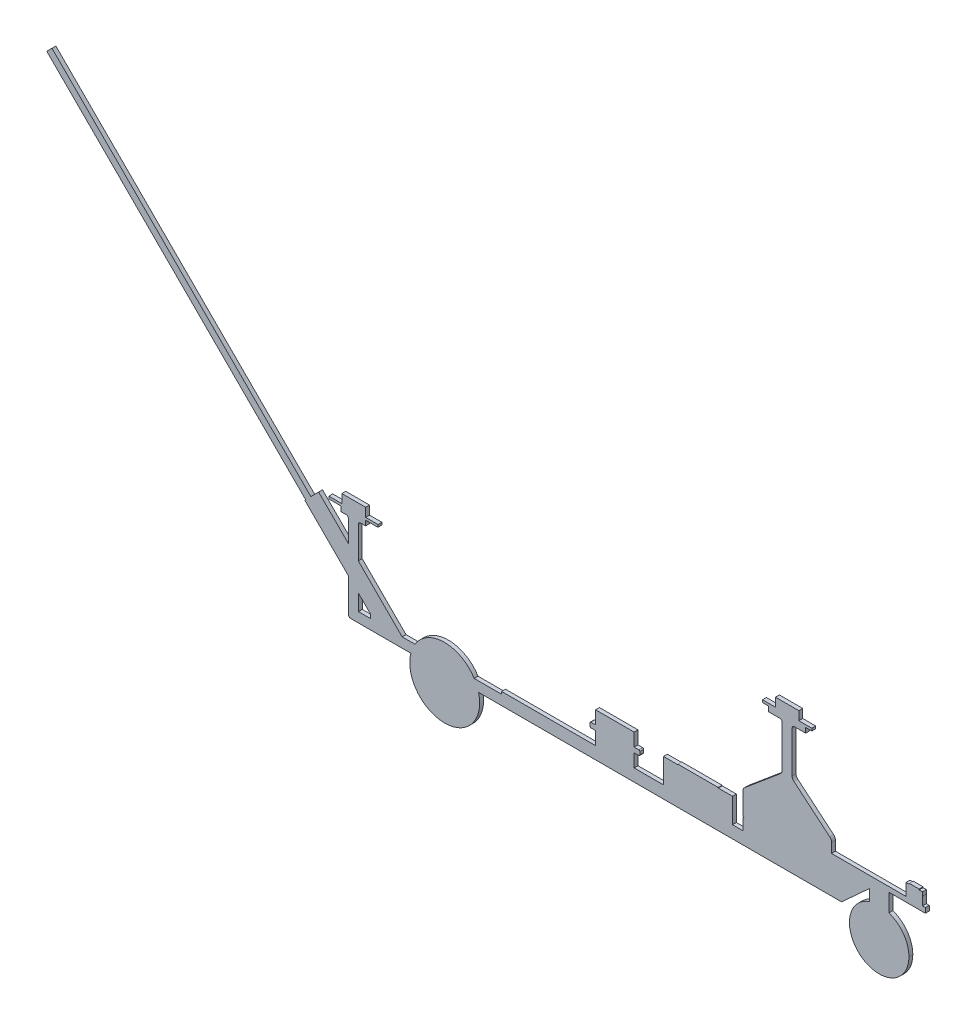
from build123d import *

# Parameters (mm, degrees)
BOSS_EXTRUDE1_DEPTH = 10


with BuildPart() as part:
    # Sketch1 → Boss-Extrude1 (new body)
    with BuildSketch(Plane.XY):
        with BuildLine():
            Line((267.700586575, -317.463793829), (267.700586575, -312.078793829))
            ThreePointArc((267.700586575, -312.078793829), (268.444535351, -310.282742605), (270.240586575, -309.538793829))
            Line((270.240586575, -309.538793829), (270.259460872, -309.538793829))
            Line((270.259460872, -309.538793829), (274.922570072, -309.538793829))
            Line((274.922570072, -309.538793829), (282.23008886, -309.538793829))
            Line((282.23008886, -309.538793829), (282.23008886, -275.862793829))
            Line((282.23008886, -275.862793829), (287.339585458, -275.862793829))
            Line((287.339585458, -275.862793829), (290.091295578, -275.862793829))
            Line((290.091295578, -275.862793829), (379.171025481, -275.862793829))
            Line((379.171025481, -275.862793829), (381.489649894, -275.862793829))
            Line((381.489649894, -275.862793829), (381.489649894, -309.538793829))
            Line((381.489649894, -309.538793829), (385.417639714, -309.538793829))
            Line((385.417639714, -309.538793829), (389.233213281, -309.538793829))
            Line((389.233213281, -309.538793829), (393.479152179, -309.538793829))
            ThreePointArc((393.479152179, -309.538793829), (395.275203403, -310.282742605), (396.019152179, -312.078793829))
            Line((396.019152179, -312.078793829), (396.019152179, -317.463793829))
            Line((396.019152179, -317.463793829), (396.019152179, -319.673793829))
            ThreePointArc((396.019152179, -319.673793829), (395.275203403, -321.469845053), (393.479152179, -322.213793829))
            Line((393.479152179, -322.213793829), (388.951444663, -322.213793829))
            Line((388.951444663, -322.213793829), (385.417639714, -322.213793829))
            Line((385.417639714, -322.213793829), (381.489649894, -322.213793829))
            Line((381.489649894, -322.213793829), (381.489649894, -355.889793829))
            Line((381.489649894, -355.889793829), (457.115985877, -355.889793829))
            Line((457.115985877, -355.889793829), (457.115985877, -349.539793829))
            Line((457.115985877, -349.539793829), (457.115985877, -292.389793829))
            Line((457.115985877, -292.389793829), (476.419985877, -292.389793829))
            Line((476.419985877, -292.389793829), (488.865985877, -292.389793829))
            Line((488.865985877, -292.389793829), (493.945985877, -292.389793829))
            Line((493.945985877, -292.389793829), (493.945985877, -291.119793829))
            Line((493.945985877, -291.119793829), (598.085985877, -291.119793829))
            Line((598.085985877, -291.119793829), (598.085985877, -292.389793829))
            Line((598.085985877, -292.389793829), (603.165985877, -292.389793829))
            Line((603.165985877, -292.389793829), (615.611985877, -292.389793829))
            Line((615.611985877, -292.389793829), (634.915985877, -292.389793829))
            Line((634.915985877, -292.389793829), (634.915985877, -349.539793829))
            Line((634.915985877, -349.539793829), (634.915985877, -355.889793829))
            Line((634.915985877, -355.889793829), (657.031320189, -355.889793829))
            Line((657.031320189, -355.889793829), (658.400586575, -355.889793829))
            Line((658.400586575, -355.889793829), (659.900586575, -355.889793829))
            Line((659.900586575, -355.889793829), (661.400586575, -355.889793829))
            Line((661.400586575, -355.889793829), (661.400586575, -329.339793829))
            ThreePointArc((661.400586575, -329.339793829), (661.418350042, -328.910347072), (661.471519082, -328.483834339))
            ThreePointArc((661.471519082, -328.483834339), (661.472919202, -328.475486411), (661.474332909, -328.467140773))
            ThreePointArc((661.474332909, -328.467140773), (661.513019714, -328.264310942), (661.559728583, -328.063176929))
            ThreePointArc((661.559728583, -328.063176929), (661.568606086, -328.028621698), (661.577720462, -327.994128189))
            ThreePointArc((661.577720462, -327.994128189), (661.627092054, -327.821784525), (661.682375168, -327.651245176))
            ThreePointArc((661.682375168, -327.651245176), (661.698029995, -327.606317848), (661.714095218, -327.561535631))
            ThreePointArc((661.714095218, -327.561535631), (661.773857223, -327.405192123), (661.83861996, -327.250852959))
            ThreePointArc((661.83861996, -327.250852959), (661.862826954, -327.196517417), (661.88765391, -327.142462335))
            ThreePointArc((661.88765391, -327.142462335), (661.955448181, -327.002554153), (662.027394622, -326.86473517))
            ThreePointArc((662.027394622, -326.86473517), (662.061810069, -326.802175293), (662.097081264, -326.740093863))
            ThreePointArc((662.097081264, -326.740093863), (662.17055696, -326.616773886), (662.247408669, -326.495529053))
            ThreePointArc((662.247408669, -326.495529053), (662.29354611, -326.426135915), (662.340789632, -326.357491027))
            ThreePointArc((662.340789632, -326.357491027), (662.417634036, -326.250634064), (662.497158295, -326.145756204))
            ThreePointArc((662.497158295, -326.145756204), (662.556365424, -326.07111286), (662.616930165, -325.997566785))
            ThreePointArc((662.616930165, -325.997566785), (662.694899071, -325.906776916), (662.774936655, -325.817805372))
            ThreePointArc((662.774936655, -325.817805372), (662.848375111, -325.739667563), (662.92340919, -325.663060703))
            ThreePointArc((662.92340919, -325.663060703), (663.000354965, -325.587683442), (663.078845535, -325.513916146))
            ThreePointArc((663.078845535, -325.513916146), (663.167446902, -325.434214232), (663.257851505, -325.356563701))
            ThreePointArc((663.257851505, -325.356563701), (663.33177553, -325.295677813), (663.406808321, -325.236163672))
            ThreePointArc((663.406808321, -325.236163672), (663.51129552, -325.156938252), (663.617747141, -325.080372634))
            ThreePointArc((663.617747141, -325.080372634), (663.686787171, -325.032849084), (663.756584208, -324.986444482))
            ThreePointArc((663.756584208, -324.986444482), (663.877439818, -324.909842166), (664.000357324, -324.836594095))
            ThreePointArc((664.000357324, -324.836594095), (664.062828156, -324.801095535), (664.125783522, -324.766463549))
            ThreePointArc((664.125783522, -324.766463549), (664.263237394, -324.694710535), (664.402769473, -324.627087601))
            ThreePointArc((664.402769473, -324.627087601), (664.457184656, -324.602090988), (664.51188408, -324.577722652))
            ThreePointArc((664.51188408, -324.577722652), (664.665903182, -324.513097218), (664.82191838, -324.453451695))
            ThreePointArc((664.82191838, -324.453451695), (664.867009853, -324.43727287), (664.912248461, -324.421510143))
            ThreePointArc((664.912248461, -324.421510143), (665.082529634, -324.366313848), (665.2546097, -324.317011109))
            ThreePointArc((665.2546097, -324.317011109), (665.289344585, -324.307831543), (665.324142063, -324.298892183))
            ThreePointArc((665.324142063, -324.298892183), (665.51010793, -324.255420089), (665.697544699, -324.218806095))
            ThreePointArc((665.697544699, -324.218806095), (665.721138934, -324.214701454), (665.744751823, -324.21070552))
            ThreePointArc((665.744751823, -324.21070552), (665.945550033, -324.181215815), (666.147346049, -324.159584082))
            ThreePointArc((666.147346049, -324.159584082), (666.159274586, -324.158554235), (666.171205462, -324.157551857))
            ThreePointArc((666.171205462, -324.157551857), (666.247461456, -324.151797814), (666.323793823, -324.147165807))
            Line((666.323793823, -324.147165807), (661.400586575, -324.139793829))
            Line((661.400586575, -324.139793829), (661.400586575, -267.41768657))
            ThreePointArc((661.400586575, -267.41768657), (662.59047768, -262.050434646), (665.937183932, -257.688922143))
            Line((665.937183932, -257.688922143), (758.463989218, -180.049713953))
            ThreePointArc((758.463989218, -180.049713953), (761.81069547, -175.68820145), (763.000586575, -170.320949526))
            Line((763.000586575, -170.320949526), (763.000586575, -63.789793829))
            ThreePointArc((763.000586575, -63.789793829), (761.140714636, -59.299665768), (756.650586575, -57.439793829))
            Line((756.650586575, -57.439793829), (728.075586575, -57.439793829))
            Line((728.075586575, -57.439793829), (728.075586575, -44.739793829))
            Line((728.075586575, -44.739793829), (712.200586575, -44.739793829))
            Line((712.200586575, -44.739793829), (712.200586575, -38.389793829))
            Line((712.200586575, -38.389793829), (745.700586575, -38.389793829))
            Line((745.700586575, -38.389793829), (745.700586575, -34.889793829))
            Line((745.700586575, -34.889793829), (745.700586575, -15.889793829))
            Line((745.700586575, -15.889793829), (748.629518763, -15.889793829))
            Line((748.629518763, -15.889793829), (752.771654387, -15.889793829))
            Line((752.771654387, -15.889793829), (759.842722199, -15.889793829))
            Line((759.842722199, -15.889793829), (791.558450951, -15.889793829))
            Line((791.558450951, -15.889793829), (798.629518763, -15.889793829))
            Line((798.629518763, -15.889793829), (802.771654387, -15.889793829))
            Line((802.771654387, -15.889793829), (805.700586575, -15.889793829))
            Line((805.700586575, -15.889793829), (805.700586575, -38.389793829))
            Line((805.700586575, -38.389793829), (839.200586575, -38.389793829))
            Line((839.200586575, -38.389793829), (839.200586575, -44.739793829))
            Line((839.200586575, -44.739793829), (823.325586575, -44.739793829))
            Line((823.325586575, -44.739793829), (823.325586575, -57.439793829))
            Line((823.325586575, -57.439793829), (794.750586575, -57.439793829))
            ThreePointArc((794.750586575, -57.439793829), (790.260458514, -59.299665768), (788.400586575, -63.789793829))
            Line((788.400586575, -63.789793829), (788.400586575, -170.320949526))
            ThreePointArc((788.400586575, -170.320949526), (789.59047768, -175.68820145), (792.937183932, -180.049713953))
            Line((792.937183932, -180.049713953), (885.463989218, -257.688922143))
            ThreePointArc((885.463989218, -257.688922143), (888.81069547, -262.050434646), (890.000586575, -267.41768657))
            Line((890.000586575, -267.41768657), (890.000586575, -292.367113794))
            Line((890.000586575, -292.367113794), (902.700586575, -292.367113794))
            Line((902.700586575, -292.367113794), (990.688767599, -292.367113794))
            Line((990.688767599, -292.367113794), (1016.088767599, -292.367113794))
            Line((1016.088767599, -292.367113794), (1049.509793752, -292.367113794))
            Line((1049.509793752, -292.367113794), (1070.482282021, -292.367113794))
            Line((1070.482282021, -292.367113794), (1082.148303226, -292.367113794))
            Line((1082.148303226, -292.367113794), (1082.148303226, -287.617113793))
            Line((1082.148303226, -287.617113793), (1082.148303226, -270.917113793))
            Line((1082.148303226, -270.917113793), (1082.448303226, -270.917113793))
            Line((1082.448303226, -270.917113793), (1082.148303226, -270.617113793))
            Line((1082.148303226, -270.617113793), (1082.148303226, -260.917113793))
            Line((1082.148303226, -260.917113793), (1082.797777447, -260.917113793))
            Line((1082.797777447, -260.917113793), (1085.09387804, -260.917113793))
            Line((1085.09387804, -260.917113793), (1090.648303226, -260.917113793))
            Line((1090.648303226, -260.917113793), (1090.648303226, -258.917113793))
            Line((1090.648303226, -258.917113793), (1107.848303226, -258.917113793))
            Line((1107.848303226, -258.917113793), (1115.648303226, -258.917113793))
            Line((1115.648303226, -258.917113793), (1115.648303226, -260.917113793))
            Line((1115.648303226, -260.917113793), (1124.148303226, -260.917113793))
            Line((1124.148303226, -260.917113793), (1124.148303226, -270.617113793))
            Line((1124.148303226, -270.617113793), (1123.848303226, -270.917113793))
            Line((1123.848303226, -270.917113793), (1124.148303226, -270.917113793))
            Line((1124.148303226, -270.917113793), (1124.148303226, -287.617113793))
            Line((1124.148303226, -287.617113793), (1124.148303226, -292.367113794))
            Line((1124.148303226, -292.367113794), (1131.731269327, -292.367113794))
            Line((1131.731269327, -292.367113794), (1131.731269327, -305.067113794))
            Line((1131.731269327, -305.067113794), (1120.13814726, -305.067113794))
            Line((1120.13814726, -305.067113794), (1070.912964773, -305.067113794))
            Line((1070.912964773, -305.067113794), (1049.940476504, -305.067113794))
            Line((1049.940476504, -305.067113794), (1038.307115018, -305.067113794))
            Line((1038.307115018, -305.067113794), (1038.307115018, -308.983793794))
            Line((1038.307115018, -308.983793794), (1037.952880133, -350.957732081))
            add(Edge.make_bspline(
                [(1037.952880133, -350.957732081), (1070.46086779, -362.271421207), (1089.362103793, -390.237536854), (1089.362103793, -423.283793794)],
                knots=[0.223415173, 0.223415173, 0.223415173, 0.223415173, 1, 1, 1, 1], degree=3, weights=[0.898365565, 0.814484235, 0.84836238, 1]))
            add(Edge.make_bspline(
                [(1089.362103793, -423.283793794), (1089.362083352, -468.143884587), (1057.641537253, -499.864744538), (1012.781931195, -499.864724097)],
                knots=[0, 0, 0, 0, 1, 1, 1, 1], degree=3, weights=[1, 0.804737854, 0.804737854, 1]))
            add(Edge.make_bspline(
                [(1012.781931195, -499.864724097), (1012.747491742, -499.864770561), (1012.713052266, -499.864793794), (1012.678612781, -499.864793794)],
                knots=[0, 0, 0, 0, 1, 1, 1, 1], degree=3, weights=[1, 0.999999848, 0.999999848, 1]))
            add(Edge.make_bspline(
                [(1012.678612781, -499.864793794), (967.818986337, -499.864793794), (936.098440277, -468.143904974), (936.098440277, -423.283793794)],
                knots=[0, 0, 0, 0, 1, 1, 1, 1], degree=3, weights=[1, 0.804737854, 0.804737854, 1]))
            add(Edge.make_bspline(
                [(936.098440277, -423.283793794), (936.098455264, -390.393550714), (954.842206706, -362.505127894), (987.153429052, -351.08204947)],
                knots=[0, 0, 0, 0, 0.773472533, 0.773472533, 0.773472533, 0.773472533], degree=3, weights=[1, 0.848970093, 0.814757671, 0.897362734]))
            Line((987.153429052, -351.08204947), (987.153429052, -322.238467379))
            Line((987.153429052, -322.238467379), (916.923752301, -386.615671068))
            ThreePointArc((916.923752301, -386.615671068), (915.730454119, -387.357937868), (914.349241466, -387.617113794))
            Line((914.349241466, -387.617113794), (903.131269327, -387.617113794))
            Line((903.131269327, -387.617113794), (890.431269327, -387.617113794))
            Line((890.431269327, -387.617113794), (-19.306063201, -387.639793829))
            ThreePointArc((-19.306063201, -387.639793829), (-106.518730673, -499.864793788), (-193.731398145, -387.639793829))
            Line((-193.731398145, -387.639793829), (-348.968730673, -387.639793829))
            ThreePointArc((-348.968730673, -387.639793829), (-352.645685935, -386.116749091), (-354.168730673, -382.439793829))
            Line((-354.168730673, -382.439793829), (-354.168730673, -367.439793829))
            Line((-354.168730673, -367.439793829), (-354.168730673, -295.658257102))
            Line((-354.168730673, -295.658257102), (-467.192316368, -182.634671407))
            Line((-467.192316368, -182.634671407), (-464.947252338, -180.389607377))
            Line((-464.947252338, -180.389607377), (-1131.731269327, 486.394409612))
            Line((-1131.731269327, 486.394409612), (-1130.599757056, 487.525921883))
            Line((-1130.599757056, 487.525921883), (-1119.392397417, 498.733281523))
            Line((-1119.392397417, 498.733281523), (-1118.260885145, 499.864793794))
            Line((-1118.260885145, 499.864793794), (-451.476868156, -166.919223196))
            Line((-451.476868156, -166.919223196), (-431.271291884, -146.713646923))
            Line((-431.271291884, -146.713646923), (-354.168730673, -223.816208134))
            Line((-354.168730673, -223.816208134), (-354.168730673, -168.116720376))
            ThreePointArc((-354.168730673, -168.116720376), (-356.028602612, -163.626592315), (-360.518730673, -161.766720376))
            Line((-360.518730673, -161.766720376), (-373.218730673, -161.766720376))
            Line((-373.218730673, -161.766720376), (-373.218730673, -149.066720376))
            Line((-373.218730673, -149.066720376), (-404.968730673, -149.066720376))
            Line((-404.968730673, -149.066720376), (-404.968730673, -142.716720376))
            Line((-404.968730673, -142.716720376), (-371.468730673, -142.716720376))
            Line((-371.468730673, -142.716720376), (-371.468730673, -120.216720376))
            Line((-371.468730673, -120.216720376), (-310.149413425, -120.216720376))
            Line((-310.149413425, -120.216720376), (-310.149413425, -142.716720376))
            Line((-310.149413425, -142.716720376), (-278.399413425, -142.716720376))
            Line((-278.399413425, -142.716720376), (-278.399413425, -149.066720376))
            Line((-278.399413425, -149.066720376), (-310.149413425, -149.066720376))
            Line((-310.149413425, -149.066720376), (-310.149413425, -161.766720376))
            Line((-310.149413425, -161.766720376), (-322.849413425, -161.766720376))
            ThreePointArc((-322.849413425, -161.766720376), (-327.339541486, -163.626592315), (-329.199413425, -168.116720376))
            Line((-329.199413425, -168.116720376), (-329.199413425, -249.216208134))
            Line((-329.199413425, -249.216208134), (-216.17582773, -362.239793829))
            Line((-216.17582773, -362.239793829), (-183.316025027, -362.239793829))
            ThreePointArc((-183.316025027, -362.239793829), (-106.949413425, -319.86479387), (-30.582801823, -362.239793829))
            Line((-30.582801823, -362.239793829), (39.874347534, -362.239793829))
            Line((39.874347534, -362.239793829), (39.874347534, -355.889793829))
            Line((39.874347534, -355.889793829), (41.874347534, -355.889793829))
            Line((41.874347534, -355.889793829), (47.874347534, -355.889793829))
            Line((47.874347534, -355.889793829), (49.874347534, -355.889793829))
            Line((49.874347534, -355.889793829), (52.048659019, -355.889793829))
            Line((52.048659019, -355.889793829), (282.23008886, -355.889793829))
            Line((282.23008886, -355.889793829), (282.23008886, -322.213793829))
            Line((282.23008886, -322.213793829), (279.868125222, -322.213793829))
            Line((279.868125222, -322.213793829), (274.494707036, -322.213793829))
            Line((274.494707036, -322.213793829), (274.476368206, -322.213793829))
            Line((274.476368206, -322.213793829), (270.259460872, -322.213793829))
            Line((270.259460872, -322.213793829), (270.240586575, -322.213793829))
            ThreePointArc((270.240586575, -322.213793829), (268.444535351, -321.469845053), (267.700586575, -319.673793829))
            Line((267.700586575, -319.673793829), (267.700586575, -317.463793829))
        make_face()
        Polygon((-298.295144978, -362.239793829), (-298.295144978, -351.531842797), (-328.768730673, -321.058257102), (-328.768730673, -362.228600376), align=None, mode=Mode.SUBTRACT)
    extrude(amount=BOSS_EXTRUDE1_DEPTH)


solid = part.part
